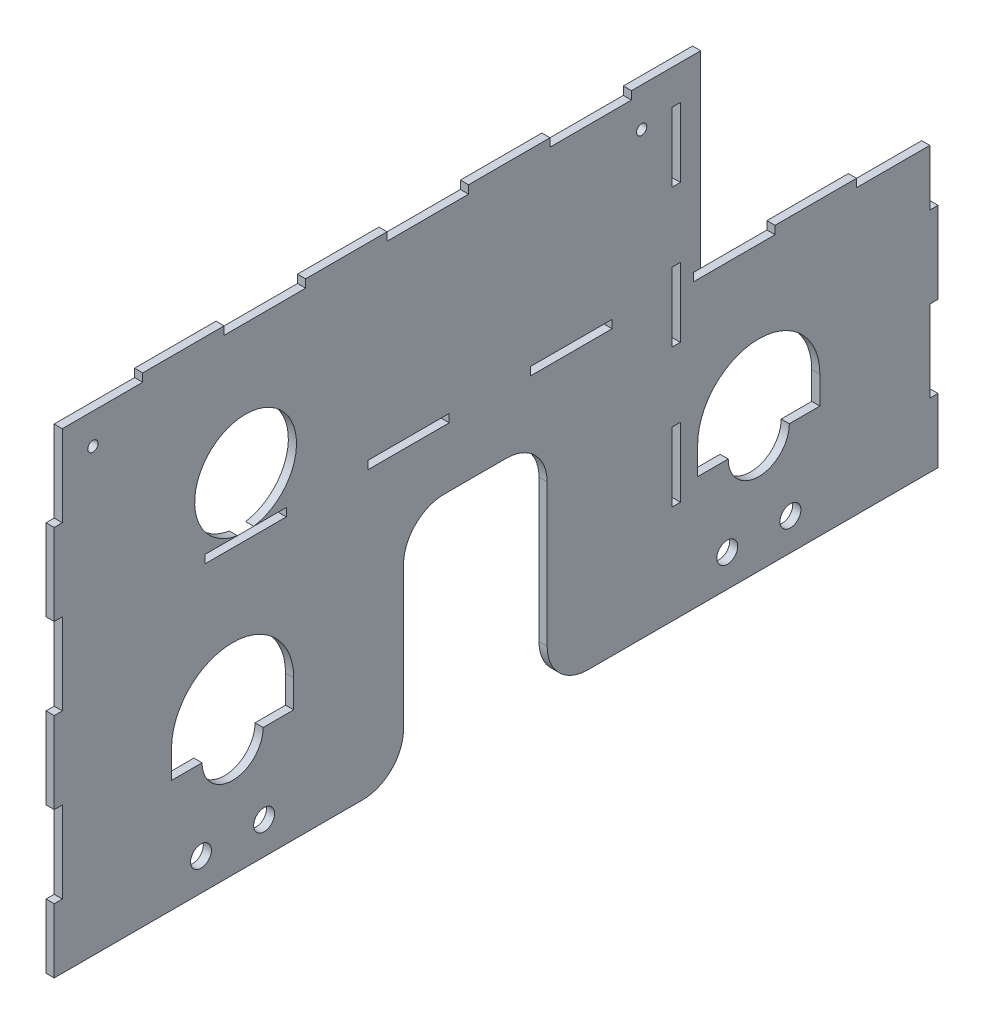
from build123d import *

# Parameters (mm, degrees)
SKETCH1_W                   = 224.46234
SKETCH1_H                   = 149.606
BOSS_EXTRUDE1_DEPTH         = 2.54
SKETCH2_W                   = 44.45
SKETCH2_H                   = 87.5411
CUT_EXTRUDE1_DEPTH          = 135.899132423
F_1_4_CLEARANCE_HOLE1_D     = 6.5278
F_1_4_CLEARANCE_HOLE1_DEPTH = 9.398
F_1_4_CLEARANCE_HOLE1_TIP   = 1.961148974
SKETCH6_W                   = 25.4
SKETCH6_H                   = 2.54
CUT_EXTRUDE2_DEPTH          = 135.899132423
LPATTERN1_COUNT             = 4
LPATTERN1_PITCH             = 50.8
SKETCH7_W                   = 2.54
SKETCH7_H                   = 21.59
CUT_EXTRUDE3_DEPTH          = 135.899132423
LPATTERN2_COUNT             = 3
LPATTERN2_PITCH             = 43.18
SKETCH8_R                   = 9.525
CUT_EXTRUDE4_DEPTH          = 135.899132423
SKETCH9_R                   = 15.875
SKETCH9_W                   = 44.7802
SKETCH9_H                   = 69.85
CUT_EXTRUDE5_DEPTH          = 135.899132423
FILLET2_R                   = 12.7
SKETCH25_W                  = 12.7
SKETCH25_H                  = 147.066
BOSS_EXTRUDE5_DEPTH         = 2.54
SKETCH16_W                  = 2.54
SKETCH16_H                  = 25.4
BOSS_EXTRUDE2_DEPTH         = 2.54
SKETCH23_W                  = 44.45
SKETCH23_H                  = 87.5411
BOSS_EXTRUDE3_DEPTH         = 2.54
SKETCH24_W                  = 33.3375
SKETCH24_H                  = 149.606
BOSS_EXTRUDE4_DEPTH         = 2.54
LPATTERN3_COUNT             = 3
LPATTERN3_PITCH             = 50.8
LPATTERN3_COUNT_DIR2        = 2
LPATTERN3_PITCH_DIR2        = 273.03984
SKETCH18_W                  = 275.57984
SKETCH18_H                  = 5.334
CUT_EXTRUDE7_DEPTH          = 169.417839014
M3_CLEARANCE_HOLE1_D        = 3.2
M3_CLEARANCE_HOLE1_DEPTH    = 9.398
M3_CLEARANCE_HOLE1_TIP      = 0.96137699
SKETCH27_W                  = 73.9775
SKETCH27_H                  = 58.7375
CUT_EXTRUDE9_DEPTH          = 2.54
CUT_EXTRUDE10_DEPTH         = 2.54
SKETCH29_W                  = 25.4
SKETCH29_H                  = 2.54
CUT_EXTRUDE11_DEPTH         = 166.946131435
LPATTERN4_COUNT             = 5
LPATTERN4_PITCH             = 50.8


with BuildPart() as part:
    # Sketch1 → Boss-Extrude1 (new body)
    with BuildSketch(Plane(origin=(0, 0, 0), x_dir=(0, 0, -1), z_dir=(1, 0, 0))):
        Rectangle(SKETCH1_W, SKETCH1_H)
    extrude(amount=BOSS_EXTRUDE1_DEPTH)

    # Sketch2 → Cut-Extrude1 (cut, through all)
    with BuildSketch(Plane(origin=(2.54, 0, 0), x_dir=(0, 0, -1), z_dir=(1, 0, 0))):
        with Locations((90.00617, 31.03245)):
            Rectangle(SKETCH2_W, SKETCH2_H)
    extrude(amount=-CUT_EXTRUDE1_DEPTH, mode=Mode.SUBTRACT)

    # 1/4 Clearance Hole1
    with Locations(Plane(origin=(2.54, 0, 0), x_dir=(0, 0, -1), z_dir=(1, 0, 0))):
        with Locations((-81.69783, -64.77), (-62.01283, -64.77), (102.09657, -64.77), (82.41157, -64.77)):
            Hole(F_1_4_CLEARANCE_HOLE1_D / 2, depth=F_1_4_CLEARANCE_HOLE1_DEPTH)
            with Locations((0, 0, -(F_1_4_CLEARANCE_HOLE1_DEPTH + F_1_4_CLEARANCE_HOLE1_TIP / 2))):  # 118° drill point
                Cone(0, F_1_4_CLEARANCE_HOLE1_D / 2, F_1_4_CLEARANCE_HOLE1_TIP, mode=Mode.SUBTRACT)

    # Sketch6 → Cut-Extrude2 (cut, through all)
    with BuildSketch(Plane(origin=(2.54, 0, 0), x_dir=(0, 0, -1), z_dir=(1, 0, 0))):
        with Locations((39.84117, 73.533)):
            Rectangle(SKETCH6_W, SKETCH6_H)
    cut_extrude2 = extrude(amount=-CUT_EXTRUDE2_DEPTH, mode=Mode.SUBTRACT)

    # LPattern1: Cut-Extrude2 ×4
    with Locations(*[(0, 0, i * LPATTERN1_PITCH) for i in range(1, LPATTERN1_COUNT)]):
        add(cut_extrude2, mode=Mode.SUBTRACT)

    # Sketch7 → Cut-Extrude3 (cut, through all)
    with BuildSketch(Plane(origin=(2.54, 0, 0), x_dir=(0, 0, -1), z_dir=(1, 0, 0))):
        with Locations((66.51117, 53.213)):
            Rectangle(SKETCH7_W, SKETCH7_H)
    cut_extrude3 = extrude(amount=-CUT_EXTRUDE3_DEPTH, mode=Mode.SUBTRACT)

    # LPattern2: Cut-Extrude3 ×3
    with Locations(*[(0, -i * LPATTERN2_PITCH, 0) for i in range(1, LPATTERN2_COUNT)]):
        add(cut_extrude3, mode=Mode.SUBTRACT)

    # Sketch8 → Cut-Extrude4 (cut, through all)
    with BuildSketch(Plane(origin=(2.54, 0, 0), x_dir=(0, 0, -1), z_dir=(1, 0, 0))):
        with Locations((92.22867, -39.7370046)):
            Circle(SKETCH8_R)
        with Locations((-71.82993, -39.7370046)):
            Circle(SKETCH8_R)
    extrude(amount=-CUT_EXTRUDE4_DEPTH, mode=Mode.SUBTRACT)

    # Sketch9 → Cut-Extrude5 (cut, through all)
    with BuildSketch(Plane(origin=(2.54, 0, 0), x_dir=(0, 0, -1), z_dir=(1, 0, 0))):
        with Locations((-67.78625, 31.7373)):
            Circle(SKETCH9_R)
        with Locations((3.84937, -39.878)):
            Rectangle(SKETCH9_W, SKETCH9_H)
    extrude(amount=-CUT_EXTRUDE5_DEPTH, mode=Mode.SUBTRACT)

    # Fillet2
    fillet2_edges = [part.edges().sort_by_distance(p)[0] for p in [
        (1.27, -74.803, 18.54073),
        (1.27, -4.953, 18.54073),
        (1.27, -4.953, -26.23947),
        (1.27, -74.803, -26.23947),
    ]]
    fillet(fillet2_edges, radius=FILLET2_R)

    # Sketch25 → Boss-Extrude5 (add)
    with BuildSketch(Plane(origin=(2.54, 0, 0), x_dir=(0, 0, -1), z_dir=(1, 0, 0))):
        with Locations((-118.58117, -1.27)):
            Rectangle(SKETCH25_W, SKETCH25_H)
    extrude(amount=-BOSS_EXTRUDE5_DEPTH)

    # Sketch16 → Boss-Extrude2 (add)
    with BuildSketch(Plane(origin=(2.54, 0, 0), x_dir=(0, 0, -1), z_dir=(1, 0, 0))):
        with Locations((-126.20117, 34.163)):
            Rectangle(SKETCH16_W, SKETCH16_H)
    boss_extrude2 = extrude(amount=-BOSS_EXTRUDE2_DEPTH)

    # Sketch23 → Boss-Extrude3 (add)
    with BuildSketch(Plane(origin=(2.54, 0, 0), x_dir=(0, 0, -1), z_dir=(1, 0, 0))):
        with Locations((90.00617, 31.03245)):
            Rectangle(SKETCH23_W, SKETCH23_H)
    extrude(amount=-BOSS_EXTRUDE3_DEPTH)

    # Sketch24 → Boss-Extrude4 (add)
    with BuildSketch(Plane(origin=(2.54, 0, 0), x_dir=(0, 0, -1), z_dir=(1, 0, 0))):
        with Locations((128.89992, 0)):
            Rectangle(SKETCH24_W, SKETCH24_H)
    extrude(amount=-BOSS_EXTRUDE4_DEPTH)

    # LPattern3: Boss-Extrude2 3 × 2
    with Locations(*[(0, -i * LPATTERN3_PITCH, -j * LPATTERN3_PITCH_DIR2) for i in range(LPATTERN3_COUNT) for j in range(LPATTERN3_COUNT_DIR2) if (i, j) != (0, 0)]):
        add(boss_extrude2)

    # Sketch18 → Cut-Extrude7 (cut, through all)
    with BuildSketch(Plane(origin=(2.54, 0, 0), x_dir=(0, 0, -1), z_dir=(1, 0, 0))):
        with Locations((10.31875, -77.47)):
            Rectangle(SKETCH18_W, SKETCH18_H)
    extrude(amount=-CUT_EXTRUDE7_DEPTH, mode=Mode.SUBTRACT)

    # M3 Clearance Hole1
    with Locations(Plane(origin=(2.54, 0, 0), x_dir=(0, 0, -1), z_dir=(1, 0, 0))):
        with Locations((-115.40617, 62.738), (55.71617, 62.738)):
            Hole(M3_CLEARANCE_HOLE1_D / 2, depth=M3_CLEARANCE_HOLE1_DEPTH)
            with Locations((0, 0, -(M3_CLEARANCE_HOLE1_DEPTH + M3_CLEARANCE_HOLE1_TIP / 2))):  # 118° drill point
                Cone(0, M3_CLEARANCE_HOLE1_D / 2, M3_CLEARANCE_HOLE1_TIP, mode=Mode.SUBTRACT)

    # Sketch27 → Cut-Extrude9 (cut)
    with BuildSketch(Plane(origin=(2.54, 0, 0), x_dir=(0, 0, -1), z_dir=(1, 0, 0))):
        with Locations((111.11992, 45.43425)):
            Rectangle(SKETCH27_W, SKETCH27_H)
    extrude(amount=-CUT_EXTRUDE9_DEPTH, mode=Mode.SUBTRACT)

    # Sketch28 → Cut-Extrude10 (cut)
    with BuildSketch(Plane.ZY):
        with BuildLine():
            Line((-111.27867, -31.1010046), (-111.27867, -39.7370046))
            Line((-111.27867, -39.7370046), (-73.17867, -39.7370046))
            Line((-73.17867, -39.7370046), (-73.17867, -31.1010046))
            ThreePointArc((-73.17867, -31.1010046), (-92.22867, -12.0510046), (-111.27867, -31.1010046))
        make_face()
        with BuildLine():
            Line((52.77993, -31.1010046), (52.77993, -39.7370046))
            Line((52.77993, -39.7370046), (90.87993, -39.7370046))
            Line((90.87993, -39.7370046), (90.87993, -31.1010046))
            ThreePointArc((90.87993, -31.1010046), (71.82993, -12.0510046), (52.77993, -31.1010046))
        make_face()
    extrude(amount=-CUT_EXTRUDE10_DEPTH, mode=Mode.SUBTRACT)

    # Sketch29 → Cut-Extrude11 (cut, through all)
    with BuildSketch(Plane(origin=(2.54, 0, 0), x_dir=(0, 0, -1), z_dir=(1, 0, 0))):
        with Locations((135.40867, 14.7955)):
            Rectangle(SKETCH29_W, SKETCH29_H)
    cut_extrude11 = extrude(amount=-CUT_EXTRUDE11_DEPTH, mode=Mode.SUBTRACT)

    # LPattern4: Cut-Extrude11 ×5
    with Locations(*[(0, 0, i * LPATTERN4_PITCH) for i in range(1, LPATTERN4_COUNT)]):
        add(cut_extrude11, mode=Mode.SUBTRACT)


solid = part.part
